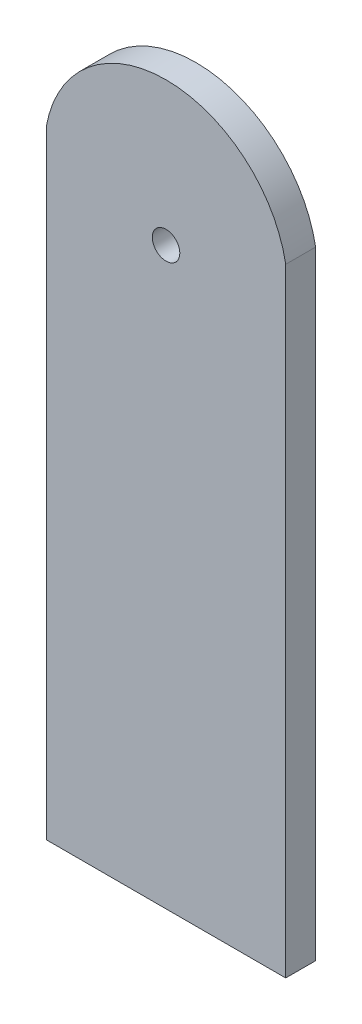
from build123d import *

# Parameters (mm, degrees)
SKETCH2_R           = 1.4605
BOSS_EXTRUDE1_DEPTH = 3.175


with BuildPart() as part:
    # Sketch2 → Boss-Extrude1 (new body)
    with BuildSketch(Plane.XY):
        with BuildLine():
            Line((0, 0), (25.4, 0))
            Line((25.4, 0), (25.4, 65.592734809))
            ThreePointArc((25.4, 65.592734809), (12.7, 76.2), (0, 65.592734809))
            Line((0, 65.592734809), (0, 0))
        make_face()
        with Locations((12.7, 60.994384123)):
            Circle(SKETCH2_R, mode=Mode.SUBTRACT)
    extrude(amount=BOSS_EXTRUDE1_DEPTH)


solid = part.part
